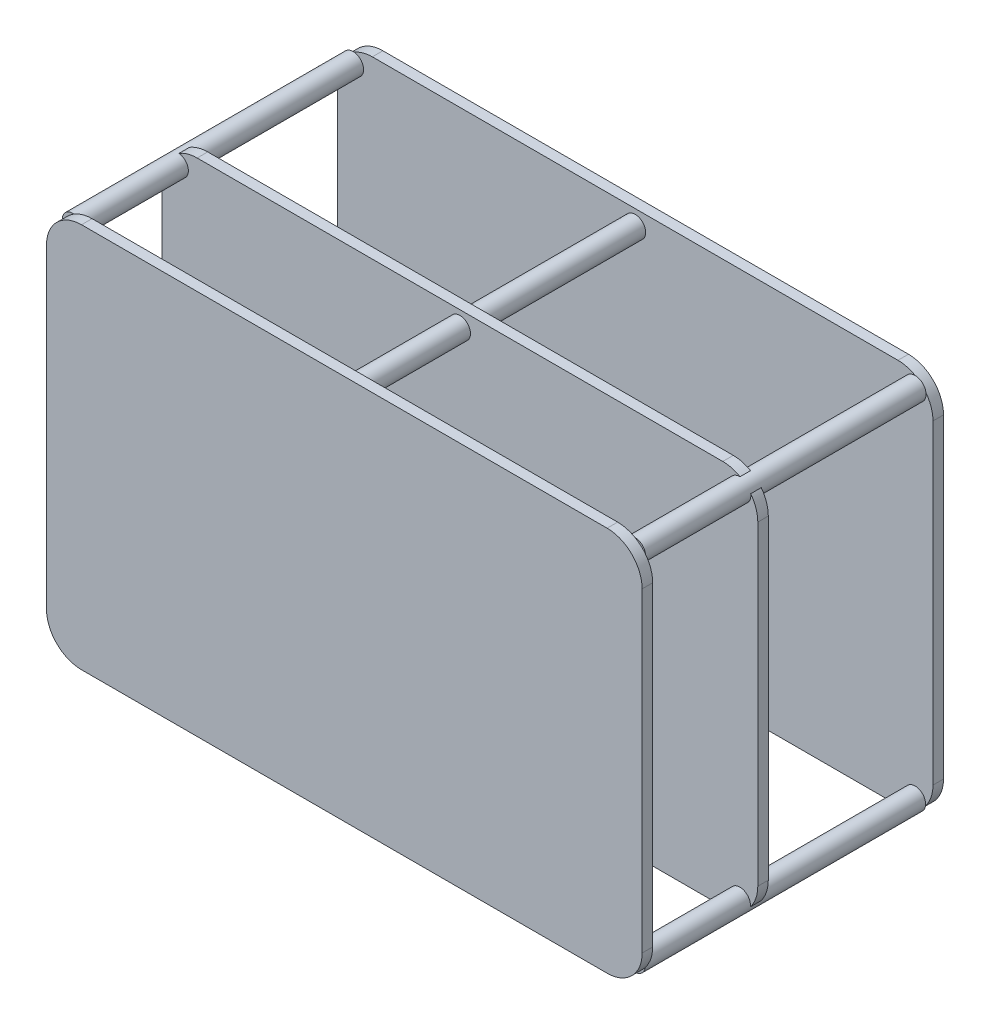
from build123d import *

# Parameters (mm, degrees)
BOT_PLATE_DEPTH     = 3
SKETCH2_R           = 3.117293964
SKETCH2_R_2         = 3
STANDOFFS_DEPTH     = 50
TOP_START           = -3
SKETCH15_R          = 3
TOP_PLATE_DEPTH     = 3
SKETCH17_R          = 3
SKETCH17_R_2        = 3.117293964
BOSS_EXTRUDE2_DEPTH = 30
BOSS_EXTRUDE3_DEPTH = 3


with BuildPart() as part:
    # Sketch1 → Bot plate (new body)
    with BuildSketch(Plane.XY):
        with BuildLine():
            Line((-75, 55), (75, 55))
            ThreePointArc((75, 55), (82.071067812, 52.071067812), (85, 45))
            Line((85, 45), (85, -45))
            ThreePointArc((85, -45), (82.071067812, -52.071067812), (75, -55))
            Line((75, -55), (-75, -55))
            ThreePointArc((-75, -55), (-82.071067812, -52.071067812), (-85, -45))
            Line((-85, -45), (-85, 45))
            ThreePointArc((-85, 45), (-82.071067812, 52.071067812), (-75, 55))
        make_face()
    extrude(amount=BOT_PLATE_DEPTH)

    # Sketch2 → Standoffs (add)
    with BuildSketch(Plane.XY.offset(3)):
        with Locations(Location((79.902698085, 50.575907713, 0), (0, 0, 89.260134502))):
            Circle(SKETCH2_R)
        with Locations((0, -50.768945529)):
            Circle(SKETCH2_R_2)
        with Locations(Location((-80.511726761, 50.575907713, 0), (0, 0, 185.784447102))):
            Circle(SKETCH2_R_2)
        with Locations((0, 50.575907713)):
            Circle(SKETCH2_R_2)
        with Locations(Location((79.902698085, -50.768945529, 0), (0, 0, 268.219191204))):
            Circle(SKETCH2_R_2)
        with Locations(Location((-80.511726761, -50.768945529, 0), (0, 0, 171.133587711))):
            Circle(SKETCH2_R_2)
    extrude(amount=STANDOFFS_DEPTH)

    # Sketch15 → top plate (add)
    with BuildSketch(Plane.XY.offset(53).offset(TOP_START)):
        with BuildLine():
            Line((75, 55), (-75, 55))
            ThreePointArc((-75, 55), (-82.071067812, 52.071067812), (-85, 45))
            Line((-85, 45), (-85, -45))
            ThreePointArc((-85, -45), (-82.071067812, -52.071067812), (-75, -55))
            Line((-75, -55), (75, -55))
            ThreePointArc((75, -55), (82.071067812, -52.071067812), (85, -45))
            Line((85, -45), (85, 45))
            ThreePointArc((85, 45), (82.071067812, 52.071067812), (75, 55))
        make_face()
        with Locations((0, 50.575907713)):
            Circle(SKETCH15_R, mode=Mode.SUBTRACT)
    extrude(amount=TOP_PLATE_DEPTH)

    # Sketch17 → Boss-Extrude2 (add)
    with BuildSketch(Plane.XY.offset(53)):
        with Locations(Location((-80.511726761, -50.768945529, 0), (0, 0, 171.133587711))):
            Circle(SKETCH17_R)
        with Locations(Location((-80.511726761, 50.575907713, 0), (0, 0, 185.784447102))):
            Circle(SKETCH17_R)
        with Locations((0, 50.575907713)):
            Circle(SKETCH17_R)
        with Locations(Location((79.902698085, 50.575907713, 0), (0, 0, 89.260134502))):
            Circle(SKETCH17_R_2)
        with Locations(Location((79.902698085, -50.768945529, 0), (0, 0, 268.219191204))):
            Circle(SKETCH17_R)
        with Locations((0, -50.768945529)):
            Circle(SKETCH17_R)
    extrude(amount=BOSS_EXTRUDE2_DEPTH)


with BuildPart() as body_2:
    # Sketch18 → Boss-Extrude3 (new body)
    with BuildSketch(Plane.XY.offset(83)):
        with BuildLine():
            Line((-75, -55), (75, -55))
            ThreePointArc((75, -55), (82.071067812, -52.071067812), (85, -45))
            Line((85, -45), (85, 45))
            ThreePointArc((85, 45), (82.071067812, 52.071067812), (75, 55))
            Line((75, 55), (-75, 55))
            ThreePointArc((-75, 55), (-82.071067812, 52.071067812), (-85, 45))
            Line((-85, 45), (-85, -45))
            ThreePointArc((-85, -45), (-82.071067812, -52.071067812), (-75, -55))
        make_face()
    extrude(amount=BOSS_EXTRUDE3_DEPTH)


solid = Compound([part.part, body_2.part])
